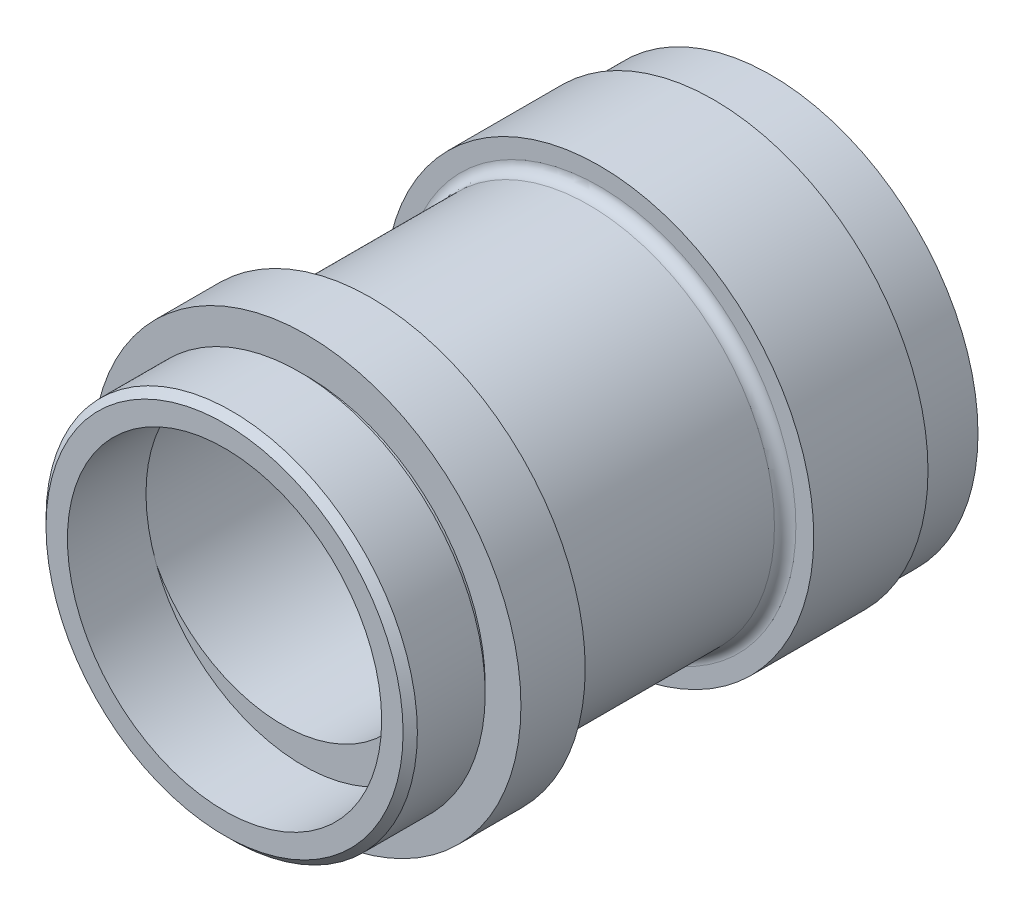
from build123d import *

# Parameters (mm, degrees)
SKETCH1_R           = 14.5
BOSS_EXTRUDE1_DEPTH = 4
SKETCH2_R           = 15
BOSS_EXTRUDE2_DEPTH = 8
SKETCH3_R           = 13
BOSS_EXTRUDE3_DEPTH = 16
SKETCH4_R           = 15
BOSS_EXTRUDE4_DEPTH = 4.5
SKETCH5_R           = 12.5
BOSS_EXTRUDE5_DEPTH = 0.5
SKETCH6_R           = 13
BOSS_EXTRUDE6_DEPTH = 5.25
SKETCH7_R           = 11
CUT_EXTRUDE1_DEPTH  = 5.5
SKETCH8_R           = 10
CUT_EXTRUDE2_DEPTH  = 32.75
FILLET1_R           = 0.75
CHAMFER1_SIZE       = 0.5
SKETCH11_W          = 1
SKETCH11_H          = 15


with BuildPart() as part:
    # Sketch1 → Boss-Extrude1 (new body)
    with BuildSketch(Plane.XY):
        Circle(SKETCH1_R)
    extrude(amount=BOSS_EXTRUDE1_DEPTH)

    # Sketch2 → Boss-Extrude2 (add)
    with BuildSketch(Plane.XY.offset(4)):
        Circle(SKETCH2_R)
    extrude(amount=BOSS_EXTRUDE2_DEPTH)

    # Sketch3 → Boss-Extrude3 (add)
    with BuildSketch(Plane.XY.offset(12)):
        Circle(SKETCH3_R)
    extrude(amount=BOSS_EXTRUDE3_DEPTH)

    # Sketch4 → Boss-Extrude4 (add)
    with BuildSketch(Plane.XY.offset(28)):
        Circle(SKETCH4_R)
    extrude(amount=BOSS_EXTRUDE4_DEPTH)

    # Sketch5 → Boss-Extrude5 (add)
    with BuildSketch(Plane.XY.offset(32.5)):
        Circle(SKETCH5_R)
    extrude(amount=BOSS_EXTRUDE5_DEPTH)

    # Sketch6 → Boss-Extrude6 (add)
    with BuildSketch(Plane.XY.offset(33)):
        Circle(SKETCH6_R)
    extrude(amount=BOSS_EXTRUDE6_DEPTH)

    # Sketch7 → Cut-Extrude1 (cut)
    with BuildSketch(Plane.XY.offset(38.25)):
        Circle(SKETCH7_R)
    extrude(amount=-CUT_EXTRUDE1_DEPTH, mode=Mode.SUBTRACT)

    # Sketch8 → Cut-Extrude2 (cut)
    with BuildSketch(Plane.XY.offset(32.75)):
        with Locations((-1.44, 0.75)):
            Circle(SKETCH8_R)
    extrude(amount=-CUT_EXTRUDE2_DEPTH, mode=Mode.SUBTRACT)

    # Fillet1
    fillet1_edges = [part.edges().sort_by_distance(p)[0] for p in [
        (-13, 0, 12),
        (-13, 0, 28),
    ]]
    fillet(fillet1_edges, radius=FILLET1_R)

    # Chamfer1
    chamfer1_edges = [part.edges().sort_by_distance(p)[0] for p in [
        (-13, 0, 38.25),
    ]]
    chamfer(chamfer1_edges, length=CHAMFER1_SIZE)

    # Sketch11 → Ø2.0 (2) Diameter Hole2 (revolve, cut)
    with BuildSketch(Plane(origin=(0, 0, 20), x_dir=(0, 0, 1), z_dir=(1, 0, 0))):
        with Locations((0.5, 7.5)):
            Rectangle(SKETCH11_W, SKETCH11_H)
    revolve(axis=Axis((0, 6.35, 20), (0, -1, 0)), mode=Mode.SUBTRACT)


solid = part.part
